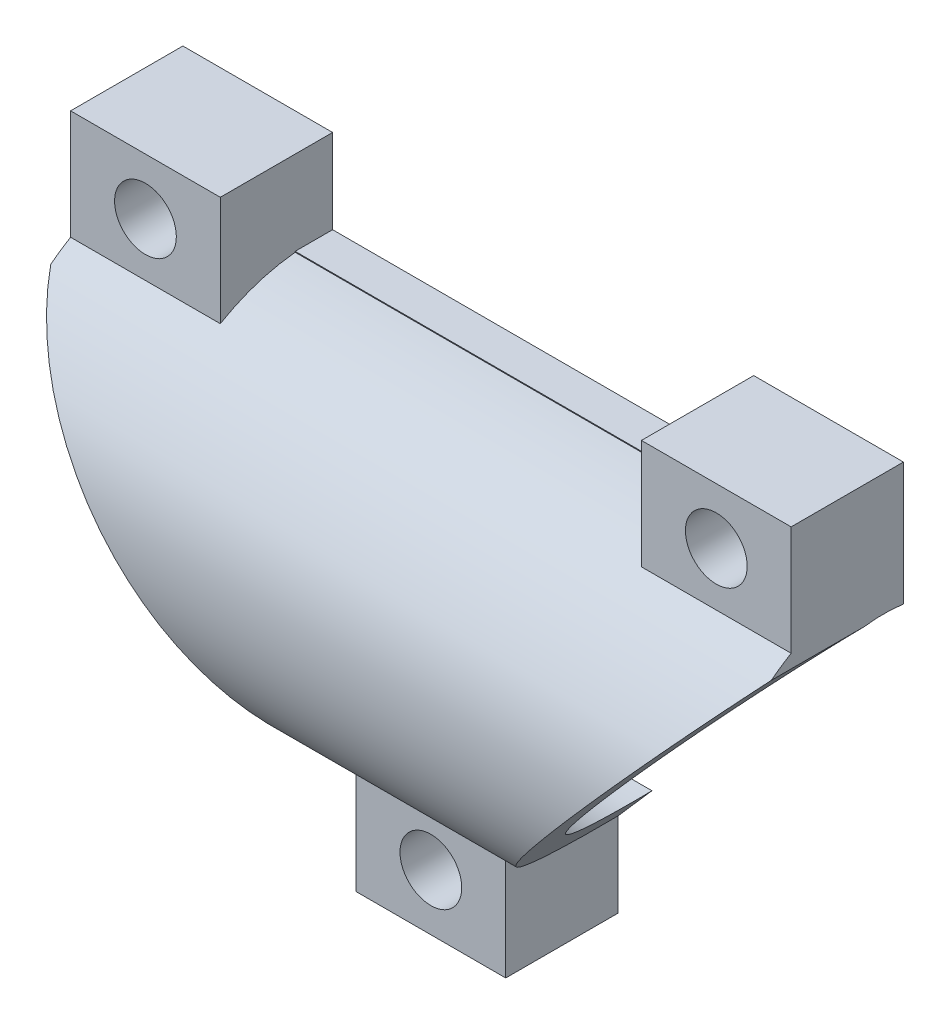
from build123d import *
from build123d.topology import SkipClean

# Parameters (mm, degrees)
SKICA1_R                            = 1.650000859
SKICA1_R_2                          = 1.650000856
SKICA1_R_3                          = 1.649999795
P_IDAT_VYSUNUT_M1_DEPTH             = 2
P_IDAT_VYSUNUT_M3_REACH             = 52.341
P_IDAT_VYSUNUT_M3_DIRECTION_2_REACH = 52.341
SKICA3_R                            = 7.749999856
ODEBRAT_VYSUNUT_M1_DEPTH            = 50
SKICA5_W                            = 5.707521684
SKICA5_H                            = 11.749115372
SKICA5_W_2                          = 4.565648586
ODEBRAT_VYSUNUT_M2_DEPTH            = 100
SKICA6_W                            = 8.00000038
SKICA6_H                            = 6.259476141
SKICA6_R                            = 1.649999795
SKICA6_W_2                          = 7.999999449
SKICA6_H_2                          = 6.147887642
SKICA6_R_2                          = 1.650000859
SKICA6_R_3                          = 1.650000856
P_IDAT_VYSUNUT_M4_DEPTH             = 4


with BuildPart() as part:
    # Skica1 → Přidat vysunutím1 (new body)
    with BuildSketch(Plane.XY):
        Polygon((19.249999896, 35.500001162), (19.249999896, 33.428542316), (4.00000019, 16.00000076), (4.00000019, 11.500000022), (-4.00000019, 11.500000022), (-4.00000019, 16.00000076), (-19.249999896, 33.42806357), (-19.249999896, 35.500001162), (-19.249999896, 39.999999106), (-11.250000447, 39.999999106), (-11.250000447, 35.500001162), (11.250000447, 35.500001162), (11.250000447, 39.999999106), (19.249999896, 39.999999106), align=None)
        with Locations((-15.249999503, 37.000001471)):
            Circle(SKICA1_R, mode=Mode.SUBTRACT)
        with Locations((15.249998879, 37.000001475)):
            Circle(SKICA1_R_2, mode=Mode.SUBTRACT)
        with Locations((1.87e-07, 14.499999779)):
            Circle(SKICA1_R_3, mode=Mode.SUBTRACT)
    extrude(amount=P_IDAT_VYSUNUT_M1_DEPTH)

    # Přidat vysunutím3: up to this face of the body (flat: up to its plane)
    p_idat_vysunut_m3_end = Plane(part.part.faces().sort_by_distance((11.625000043, 24.714271538, 1))[0])
    # Skica2 → Přidat vysunutím3 (add, up to the picked face)
    with BuildSketch(Plane(origin=(-11.250000447, 0, 0), x_dir=(0, 0, -1), z_dir=(1, 0, 0)), mode=Mode.PRIVATE) as p_idat_vysunut_m3_sk1:
        with BuildLine():
            Line((-2, 35.453607186), (-2, 33.44155343))
            ThreePointArc((-2, 33.44155343), (-8.800000314, 25.749999709), (-2, 18.058445988))
            Line((-2, 18.058445988), (-2, 16.046392232))
            ThreePointArc((-2, 16.046392232), (-10.800000314, 25.749999709), (-2, 35.453607186))
        make_face()
    p_idat_vysunut_m3_tool1 = split(extrude(p_idat_vysunut_m3_sk1.sketch, amount=P_IDAT_VYSUNUT_M3_REACH, mode=Mode.PRIVATE), bisect_by=p_idat_vysunut_m3_end, keep=Keep.BOTH, mode=Mode.PRIVATE)
    add(p_idat_vysunut_m3_tool1.solids().sort_by(Axis((-11.25, 17.052419, 2.213092), (1, 0, 0)))[0])

    # Přidat vysunutím3 direction 2: up to this face of the body (flat: up to its plane)
    p_idat_vysunut_m3_direction_2_end = Plane(part.part.faces().sort_by_distance((-11.625000043, 24.714032165, 1))[0])
    # Skica2 → Přidat vysunutím3 direction 2 (add, up to the picked face)
    with BuildSketch(Plane(origin=(-11.250000447, 0, 0), x_dir=(0, 0, -1), z_dir=(1, 0, 0)), mode=Mode.PRIVATE) as p_idat_vysunut_m3_direction_2_sk1:
        with BuildLine():
            Line((-2, 35.453607186), (-2, 33.44155343))
            ThreePointArc((-2, 33.44155343), (-8.800000314, 25.749999709), (-2, 18.058445988))
            Line((-2, 18.058445988), (-2, 16.046392232))
            ThreePointArc((-2, 16.046392232), (-10.800000314, 25.749999709), (-2, 35.453607186))
        make_face()
    p_idat_vysunut_m3_direction_2_tool1 = split(extrude(p_idat_vysunut_m3_direction_2_sk1.sketch, amount=-P_IDAT_VYSUNUT_M3_DIRECTION_2_REACH, mode=Mode.PRIVATE), bisect_by=p_idat_vysunut_m3_direction_2_end, keep=Keep.BOTH, mode=Mode.PRIVATE)
    add(p_idat_vysunut_m3_direction_2_tool1.solids().sort_by(Axis((-11.25, 17.052419, 2.213092), (-1, 0, 0)))[0])

    # Skica3 → Odebrat vysunutím1 (cut, symmetric)
    with SkipClean():  # the faces are left unmerged after this step: merging them gives an invalid solid
        with BuildSketch(Plane(origin=(-11.250000447, 0, 0), x_dir=(0, 0, -1), z_dir=(1, 0, 0))):
            with Locations((-1.050000457, 25.749999709)):
                Circle(SKICA3_R)
        extrude(amount=ODEBRAT_VYSUNUT_M1_DEPTH, both=True, mode=Mode.SUBTRACT)

    # Skica5 → Odebrat vysunutím2 (cut)
    with BuildSketch(Plane(origin=(0, 0, 0), x_dir=(-1, 0, 0), z_dir=(0, 0, -1))):
        Polygon((4.00000019, 16.00000076), (13.371125893, 26.709546366), (13.371125893, 14.106664416), align=None)
        with Locations((22.103760738, 34.12544142)):
            Rectangle(SKICA5_W, SKICA5_H)
        with Locations((-21.532824189, 34.12544142)):
            Rectangle(SKICA5_W_2, SKICA5_H)
    extrude(amount=-ODEBRAT_VYSUNUT_M2_DEPTH, mode=Mode.SUBTRACT)

    # Skica6 → Přidat vysunutím4 (add)
    # profile 1 of 3: a face of its own
    with BuildSketch(Plane.XY.offset(2)):
        with Locations((0, 14.629738093)):
            Rectangle(SKICA6_W, SKICA6_H)
        with Locations((1.87e-07, 14.499999779)):
            Circle(SKICA6_R, mode=Mode.SUBTRACT)
    # profile 2 of 3: a face of its own
    with BuildSketch(Plane.XY.offset(2)):
        with Locations((-15.250000172, 36.926055285)):
            Rectangle(SKICA6_W_2, SKICA6_H_2)
        with Locations((-15.249999503, 37.000001471)):
            Circle(SKICA6_R_2, mode=Mode.SUBTRACT)
    # profile 3 of 3: a face of its own
    with BuildSketch(Plane.XY.offset(2)):
        with Locations((15.250000172, 36.926055285)):
            Rectangle(SKICA6_W_2, SKICA6_H_2)
        with Locations((15.249998879, 37.000001475)):
            Circle(SKICA6_R_3, mode=Mode.SUBTRACT)
    extrude(amount=P_IDAT_VYSUNUT_M4_DEPTH)


solid = part.part
